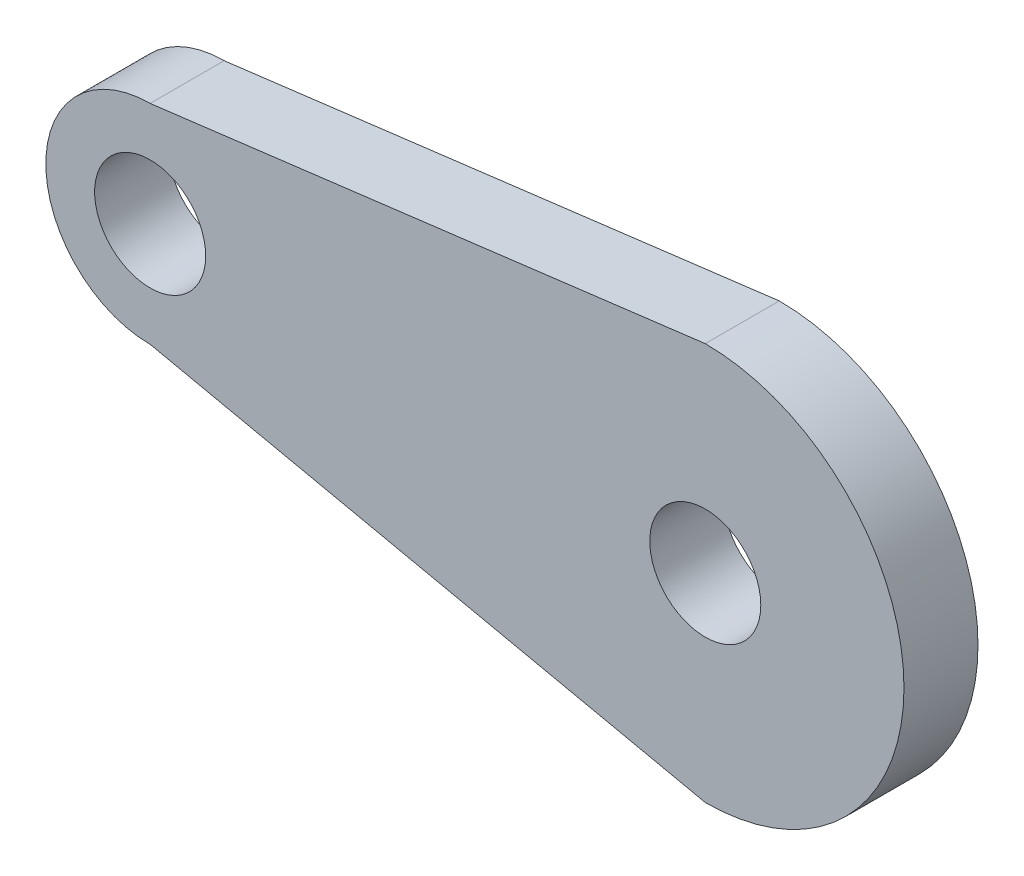
from build123d import *

# Parameters (mm, degrees)
SKETCH1_R           = 1.5
BOSS_EXTRUDE1_DEPTH = 2


with BuildPart() as part:
    # Sketch1 → Boss-Extrude1 (new body)
    with BuildSketch(Plane.XY):
        with BuildLine():
            Line((0, 0), (15, 1.879194631))
            ThreePointArc((15, 1.879194631), (20.369127517, -3.489932886), (15, -8.859060403))
            Line((15, -8.859060403), (0, -5.637583893))
            ThreePointArc((0, -5.637583893), (-2.818791946, -2.818791946), (0, 0))
        make_face()
        with Locations((0, -2.818791946)):
            Circle(SKETCH1_R, mode=Mode.SUBTRACT)
        with Locations((15, -3.489932886)):
            Circle(SKETCH1_R, mode=Mode.SUBTRACT)
    extrude(amount=BOSS_EXTRUDE1_DEPTH)


solid = part.part
